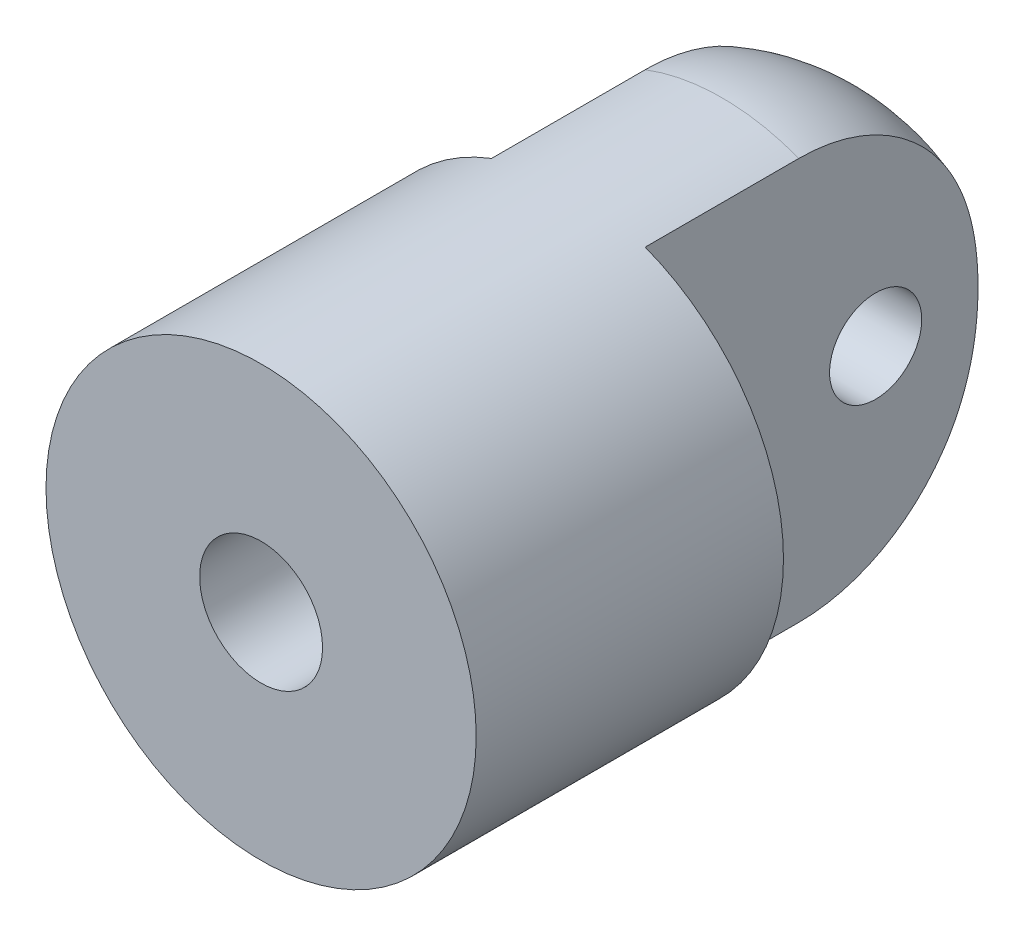
from build123d import *

# Parameters (mm, degrees)
SKETCH2_R          = 4
CUT_EXTRUDE1_DEPTH = 30
SKETCH3_W          = 19.126095086
SKETCH3_H          = 32.253484506
SKETCH3_W_2        = 14.725893552
SKETCH3_H_2        = 25.816213186
CUT_EXTRUDE2_DEPTH = 15
SKETCH4_R          = 3
CUT_EXTRUDE3_DEPTH = 30


with BuildPart() as part:
    # Sketch1 → Revolve1 (revolve)
    with BuildSketch(Plane(origin=(0, 0, 0), x_dir=(0, 0, -1), z_dir=(1, 0, 0)), mode=Mode.PRIVATE) as revolve1_sk:
        with BuildLine():
            Line((0, 0), (0, 14))
            Line((0, 14), (30, 14))
            ThreePointArc((30, 14), (39.186081867, 9.751268794), (41.896907171, 0))
            Line((41.896907171, 0), (0, 0))
        make_face()
    revolve(revolve1_sk.sketch.rotate(Axis((0, 0, 8.753832377), (0, 0, -1)), 90), axis=Axis((0, 0, 8.753832377), (0, 0, -1)))

    # Sketch2 → Cut-Extrude1 (cut)
    with BuildSketch(Plane.XY):
        Circle(SKETCH2_R)
    extrude(amount=-CUT_EXTRUDE1_DEPTH, mode=Mode.SUBTRACT)

    # Sketch3 → Cut-Extrude2 (cut, symmetric)
    with BuildSketch(Plane(origin=(0, 0, 0), x_dir=(1, 0, 0), z_dir=(0, 1, 0))):
        with Locations((-14.563047543, 36.126742253)):
            Rectangle(SKETCH3_W, SKETCH3_H)
        with Locations((12.362946776, 32.908106593)):
            Rectangle(SKETCH3_W_2, SKETCH3_H_2)
    extrude(amount=CUT_EXTRUDE2_DEPTH, both=True, mode=Mode.SUBTRACT)

    # Sketch4 → Cut-Extrude3 (cut)
    with BuildSketch(Plane(origin=(5, 0, 0), x_dir=(0, 0, -1), z_dir=(1, 0, 0))):
        with Locations((35, 0)):
            Circle(SKETCH4_R)
    extrude(amount=-CUT_EXTRUDE3_DEPTH, mode=Mode.SUBTRACT)


solid = part.part
